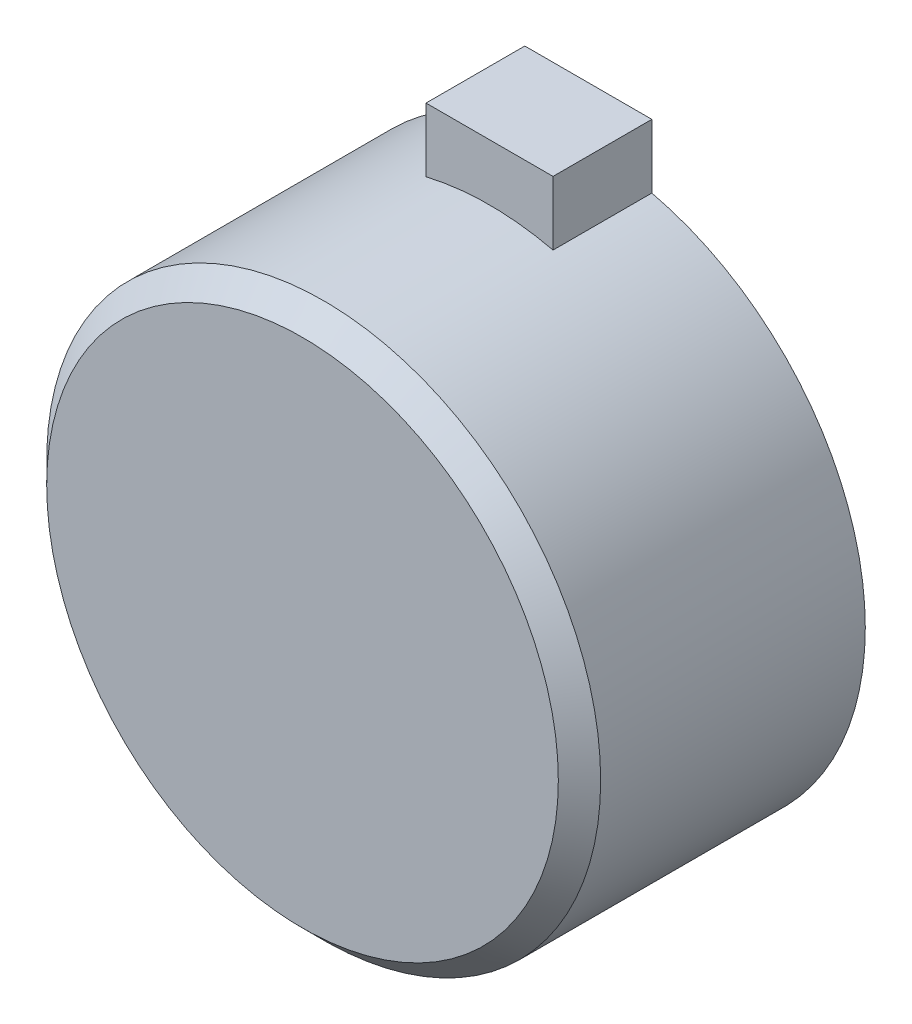
from build123d import *

# Parameters (mm, degrees)
SK_REARHOLE_R           = 1.25
REAR_TAPPED_HOLE_DEPTH  = 8
REAR_HOLE_PATTERN_COUNT = 6
SK_CONNECTOR_W          = 18
SK_CONNECTOR_H          = 12
CONNECTOR_ZONE_DEPTH    = 14


with BuildPart() as part:
    # SK_Body → Housing_Body (revolve)
    with BuildSketch(Plane(origin=(0, 0, 0), x_dir=(1, 0, 0), z_dir=(0, 1, 0))):
        Polygon((0, 0), (36.25, 0), (39.25, 3), (39.25, 40.5), (36.25, 40.5), (0, 40.5), align=None)
    revolve(axis=Axis((0, 0, 10), (0, 0, -1)))

    # SK_RearHole → Rear_Tapped_Hole (cut)
    with BuildSketch(Plane.XY.offset(-40.5)):
        with Locations((33, 0)):
            Circle(SK_REARHOLE_R)
    rear_tapped_hole = extrude(amount=REAR_TAPPED_HOLE_DEPTH, mode=Mode.SUBTRACT)

    # Rear_Hole_Pattern: Rear_Tapped_Hole ×6 about axis
    rear_hole_pattern_axis = Axis((0, 0, -42.525), (0, 0, 1))
    for i in range(1, REAR_HOLE_PATTERN_COUNT):
        add(rear_tapped_hole.rotate(rear_hole_pattern_axis, i * 360 / REAR_HOLE_PATTERN_COUNT), mode=Mode.SUBTRACT)

    # SK_Connector → Connector_Zone (add)
    with BuildSketch(Plane.XY.offset(-40.5)):
        with Locations((0, 41.25)):
            Rectangle(SK_CONNECTOR_W, SK_CONNECTOR_H)
    extrude(amount=CONNECTOR_ZONE_DEPTH)


solid = part.part
